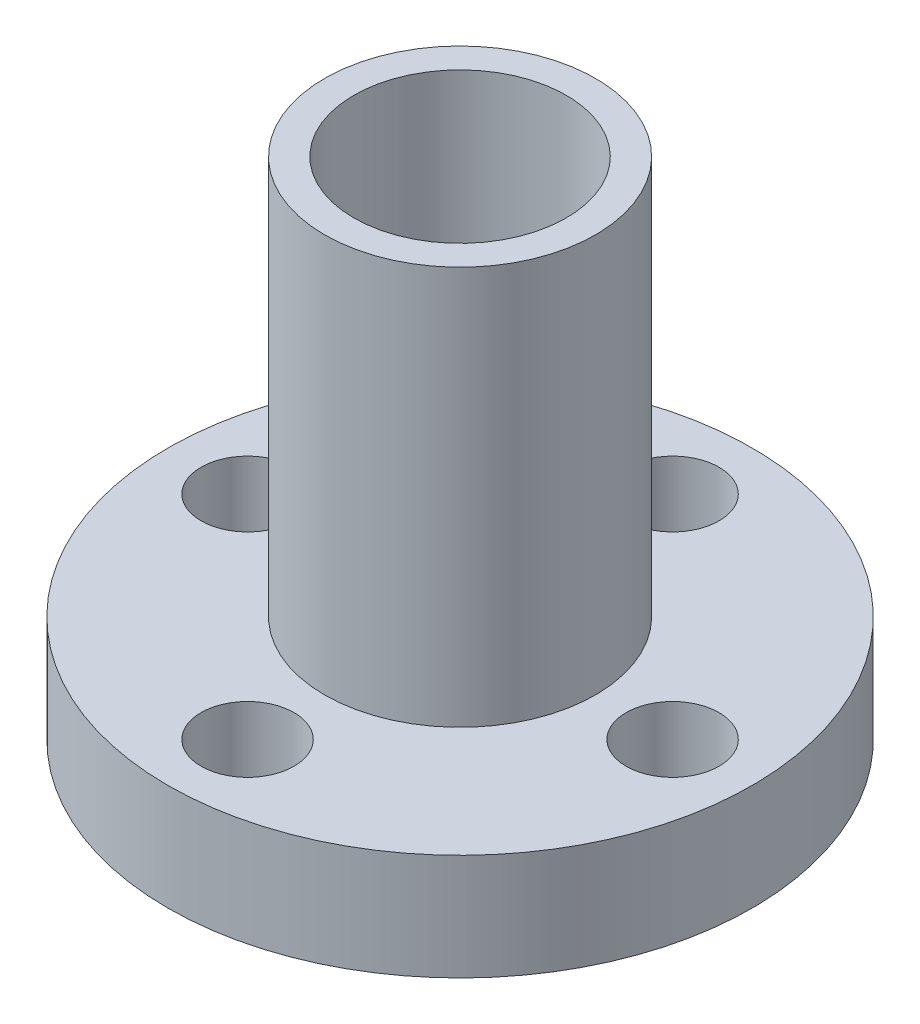
from build123d import *

# Parameters (mm, degrees)
SKETCH1_R           = 11
BOSS_EXTRUDE1_DEPTH = 4
SKETCH2_R           = 5.1
BOSS_EXTRUDE2_DEPTH = 15
SKETCH3_R           = 4
CUT_EXTRUDE1_DEPTH  = 25.556058316
SKETCH4_R           = 1.75
CUT_EXTRUDE2_DEPTH  = 22.610182785


with BuildPart() as part:
    # Sketch1 → Boss-Extrude1 (new body)
    with BuildSketch(Plane(origin=(0, 0, 0), x_dir=(1, 0, 0), z_dir=(0, 1, 0))):
        with Locations(Location((0, 0, 0), (0, 0, 270))):
            Circle(SKETCH1_R)
    extrude(amount=BOSS_EXTRUDE1_DEPTH)

    # Sketch2 → Boss-Extrude2 (add)
    with BuildSketch(Plane(origin=(0, 4, 0), x_dir=(1, 0, 0), z_dir=(0, 1, 0))):
        with Locations(Location((0, 0, 0), (0, 0, 270))):
            Circle(SKETCH2_R)
    extrude(amount=BOSS_EXTRUDE2_DEPTH)

    # Sketch3 → Cut-Extrude1 (cut, through all)
    with BuildSketch(Plane(origin=(0, 19, 0), x_dir=(1, 0, 0), z_dir=(0, 1, 0))):
        with Locations(Location((0, 0, 0), (0, 0, 270))):
            Circle(SKETCH3_R)
    extrude(amount=-CUT_EXTRUDE1_DEPTH, mode=Mode.SUBTRACT)

    # Sketch4 → Cut-Extrude2 (cut, through all)
    with BuildSketch(Plane(origin=(0, 4, 0), x_dir=(1, 0, 0), z_dir=(0, 1, 0))):
        with Locations(Location((0, 8, 0), (0, 0, 270))):
            Circle(SKETCH4_R)
        with Locations(Location((0, -8, 0), (0, 0, 270))):
            Circle(SKETCH4_R)
        with Locations(Location((-8, 0, 0), (0, 0, 270))):
            Circle(SKETCH4_R)
        with Locations(Location((8, 0, 0), (0, 0, 270))):
            Circle(SKETCH4_R)
    extrude(amount=-CUT_EXTRUDE2_DEPTH, mode=Mode.SUBTRACT)


solid = part.part
